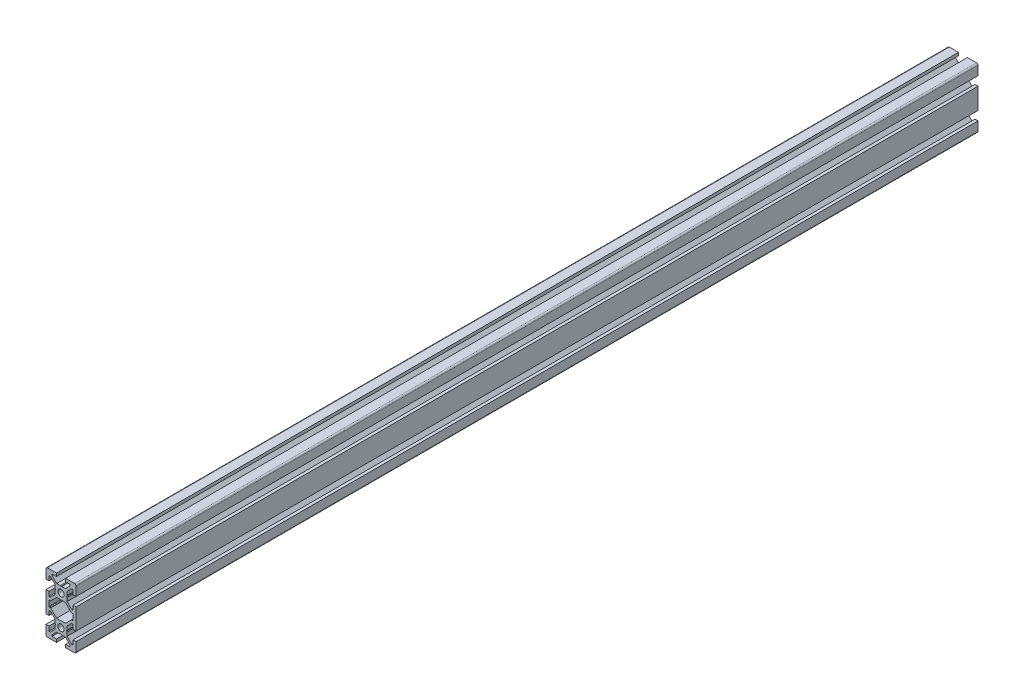
from build123d import *

# Parameters (mm, degrees)
SKETCH1_R           = 2.1
BOSS_EXTRUDE1_DEPTH = 600


with BuildPart() as part:
    # Sketch1 → Boss-Extrude1 (new body)
    with BuildSketch(Plane.XY):
        with BuildLine():
            Line((-8, -16), (-8, -13))
            Line((-8, -13), (-10, -13))
            Line((-10, -13), (-10, -19))
            ThreePointArc((-10, -19), (-9.707106781, -19.707106781), (-9, -20))
            Line((-9, -20), (-3, -20))
            Line((-3, -20), (-3, -18))
            Line((-3, -18), (-6, -18))
            Line((-6, -18), (-6, -17.060660172))
            Line((-6, -17.060660172), (-2.939339828, -14))
            Line((-2.939339828, -14), (-0.519615242, -14))
            Line((-0.519615242, -14), (0, -13.7))
            Line((0, -13.7), (0.519615242, -14))
            Line((0.519615242, -14), (2.939339828, -14))
            Line((2.939339828, -14), (6, -17.060660172))
            Line((6, -17.060660172), (6, -18))
            Line((6, -18), (3, -18))
            Line((3, -18), (3, -20))
            Line((3, -20), (9, -20))
            ThreePointArc((9, -20), (9.707106781, -19.707106781), (10, -19))
            Line((10, -19), (10, -13))
            Line((10, -13), (8, -13))
            Line((8, -13), (8, -16))
            Line((8, -16), (7.060660172, -16))
            Line((7.060660172, -16), (4, -12.939339828))
            Line((4, -12.939339828), (4, -10.519615242))
            Line((4, -10.519615242), (3.7, -10))
            Line((3.7, -10), (4, -9.480384758))
            Line((4, -9.480384758), (4, -7.060660172))
            Line((4, -7.060660172), (7.060660172, -4))
            Line((7.060660172, -4), (8, -4))
            Line((8, -4), (8, -7))
            Line((8, -7), (10, -7))
            Line((10, -7), (10, 7))
            Line((10, 7), (8, 7))
            Line((8, 7), (8, 4))
            Line((8, 4), (7.060660172, 4))
            Line((7.060660172, 4), (4, 7.060660172))
            Line((4, 7.060660172), (4, 9.480384758))
            Line((4, 9.480384758), (3.7, 10))
            Line((3.7, 10), (4, 10.519615242))
            Line((4, 10.519615242), (4, 12.939339828))
            Line((4, 12.939339828), (7.060660172, 16))
            Line((7.060660172, 16), (8, 16))
            Line((8, 16), (8, 13))
            Line((8, 13), (10, 13))
            Line((10, 13), (10, 19))
            ThreePointArc((10, 19), (9.707106781, 19.707106781), (9, 20))
            Line((9, 20), (3, 20))
            Line((3, 20), (3, 18))
            Line((3, 18), (6, 18))
            Line((6, 18), (6, 17.060660172))
            Line((6, 17.060660172), (2.939339828, 14))
            Line((2.939339828, 14), (0.519615242, 14))
            Line((0.519615242, 14), (0, 13.7))
            Line((0, 13.7), (-0.519615242, 14))
            Line((-0.519615242, 14), (-2.939339828, 14))
            Line((-2.939339828, 14), (-6, 17.060660172))
            Line((-6, 17.060660172), (-6, 18))
            Line((-6, 18), (-3, 18))
            Line((-3, 18), (-3, 20))
            Line((-3, 20), (-9, 20))
            ThreePointArc((-9, 20), (-9.707106781, 19.707106781), (-10, 19))
            Line((-10, 19), (-10, 13))
            Line((-10, 13), (-8, 13))
            Line((-8, 13), (-8, 16))
            Line((-8, 16), (-7.060660172, 16))
            Line((-7.060660172, 16), (-4, 12.939339828))
            Line((-4, 12.939339828), (-4, 10.519615242))
            Line((-4, 10.519615242), (-3.7, 10))
            Line((-3.7, 10), (-4, 9.480384758))
            Line((-4, 9.480384758), (-4, 7.060660172))
            Line((-4, 7.060660172), (-7.060660172, 4))
            Line((-7.060660172, 4), (-8, 4))
            Line((-8, 4), (-8, 7))
            Line((-8, 7), (-10, 7))
            Line((-10, 7), (-10, -7))
            Line((-10, -7), (-8, -7))
            Line((-8, -7), (-8, -4))
            Line((-8, -4), (-7.060660172, -4))
            Line((-7.060660172, -4), (-4, -7.060660172))
            Line((-4, -7.060660172), (-4, -9.480384758))
            Line((-4, -9.480384758), (-3.7, -10))
            Line((-3.7, -10), (-4, -10.519615242))
            Line((-4, -10.519615242), (-4, -12.939339828))
            Line((-4, -12.939339828), (-7.060660172, -16))
            Line((-7.060660172, -16), (-8, -16))
        make_face()
        with Locations(Location((0, -10, 0), (0, 0, 180))):
            Circle(SKETCH1_R, mode=Mode.SUBTRACT)
        with Locations(Location((0, 10, 0), (0, 0, 180))):
            Circle(SKETCH1_R, mode=Mode.SUBTRACT)
        with BuildLine():
            Line((-7.063603897, -2), (-7.7, -2))
            ThreePointArc((-7.7, -2), (-7.912132034, -1.912132034), (-8, -1.7))
            Line((-8, -1.7), (-8, 1.7))
            ThreePointArc((-8, 1.7), (-7.912132034, 1.912132034), (-7.7, 2))
            Line((-7.7, 2), (-7.063603897, 2))
            ThreePointArc((-7.063603897, 2), (-6.948798867, 2.02283614), (-6.851471863, 2.087867966))
            Line((-6.851471863, 2.087867966), (-2.939339828, 6))
            Line((-2.939339828, 6), (2.939339828, 6))
            Line((2.939339828, 6), (6.851471863, 2.087867966))
            ThreePointArc((6.851471863, 2.087867966), (6.948798867, 2.02283614), (7.063603897, 2))
            Line((7.063603897, 2), (7.7, 2))
            ThreePointArc((7.7, 2), (7.912132034, 1.912132034), (8, 1.7))
            Line((8, 1.7), (8, -1.7))
            ThreePointArc((8, -1.7), (7.912132034, -1.912132034), (7.7, -2))
            Line((7.7, -2), (7.063603897, -2))
            ThreePointArc((7.063603897, -2), (6.948798867, -2.02283614), (6.851471863, -2.087867966))
            Line((6.851471863, -2.087867966), (2.939339828, -6))
            Line((2.939339828, -6), (-2.939339828, -6))
            Line((-2.939339828, -6), (-6.851471863, -2.087867966))
            ThreePointArc((-6.851471863, -2.087867966), (-6.948798867, -2.02283614), (-7.063603897, -2))
        make_face(mode=Mode.SUBTRACT)
    extrude(amount=-BOSS_EXTRUDE1_DEPTH)


solid = part.part
